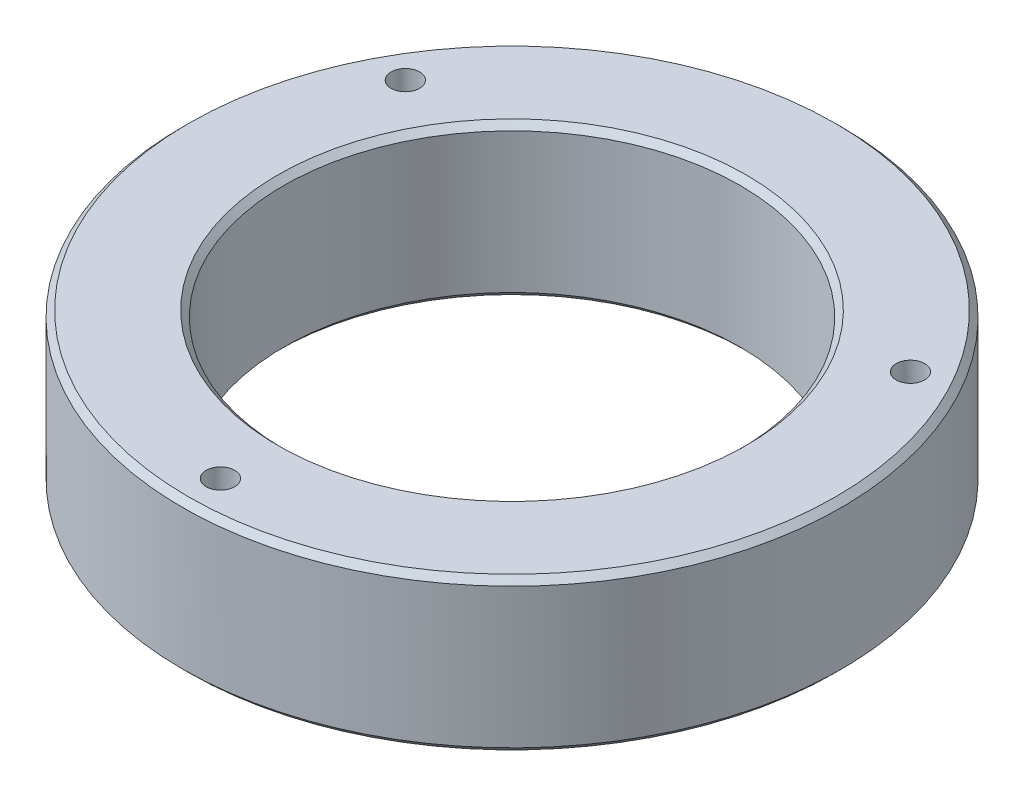
from build123d import *

# Parameters (mm, degrees)
SKETCH1_W           = 38.1
SKETCH1_H           = 25.3746
CHAMFER1_SIZE       = 1.524
CUT_EXTRUDE2_START  = -19.05
SKETCH2_R           = 3.5687
CUT_EXTRUDE2_DEPTH  = 76.2
CUT_EXTRUDE4_START  = -19.05
SKETCH3_R           = 5.5626
CUT_EXTRUDE4_DEPTH  = 9.652
CUT_EXTRUDE6_START  = -19.05
SKETCH4_R           = 3.5687
CUT_EXTRUDE6_DEPTH  = 76.2
CUT_EXTRUDE8_START  = -19.05
SKETCH5_R           = 5.5626
CUT_EXTRUDE8_DEPTH  = 9.652
CUT_EXTRUDE10_START = -19.05
SKETCH6_R           = 3.5687
CUT_EXTRUDE10_DEPTH = 76.2
CUT_EXTRUDE12_START = -19.05
SKETCH7_R           = 5.5626
CUT_EXTRUDE12_DEPTH = 9.652
CUT_EXTRUDE14_START = -19.05
SKETCH8_R           = 3.96875
CUT_EXTRUDE14_DEPTH = 25.4
CUT_EXTRUDE16_START = -19.05
SKETCH9_R           = 3.96875
CUT_EXTRUDE16_DEPTH = 25.4


with BuildPart() as part:
    # Sketch1 → Revolve1 (revolve)
    with BuildSketch(Plane(origin=(0, 0, 0), x_dir=(0, 1, 0), z_dir=(0, 0, 1)), mode=Mode.PRIVATE) as revolve1_sk:
        with Locations((0, 69.8373)):
            Rectangle(SKETCH1_W, SKETCH1_H)
    revolve(revolve1_sk.sketch.rotate(Axis((0, -44.45, 0), (0, 1, 0)), 270), axis=Axis((0, -44.45, 0), (0, 1, 0)))

    # Chamfer1
    chamfer1_edges = [part.edges().sort_by_distance(p)[0] for p in [
        (0, -19.05, 57.15),
        (0, 19.05, 57.15),
        (0, 19.05, 82.5246),
        (0, -19.05, 82.5246),
    ]]
    chamfer(chamfer1_edges, length=CHAMFER1_SIZE)

    # Sketch2 → Cut-Extrude2 (cut)
    with BuildSketch(Plane(origin=(0, 0, 0), x_dir=(-1, 0, 0), z_dir=(0, 1, 0)).offset(CUT_EXTRUDE2_START)):
        with Locations(Location((0, 73.025, 0), (0, 0, 270))):
            Circle(SKETCH2_R)
    extrude(amount=CUT_EXTRUDE2_DEPTH, mode=Mode.SUBTRACT)

    # Sketch3 → Cut-Extrude4 (cut)
    with BuildSketch(Plane(origin=(0, 0, 0), x_dir=(-1, 0, 0), z_dir=(0, 1, 0)).offset(CUT_EXTRUDE4_START)):
        with Locations(Location((0, 73.025, 0), (0, 0, 90))):
            Circle(SKETCH3_R)
    extrude(amount=CUT_EXTRUDE4_DEPTH, mode=Mode.SUBTRACT)

    # Sketch4 → Cut-Extrude6 (cut)
    with BuildSketch(Plane(origin=(0, 0, 0), x_dir=(-1, 0, 0), z_dir=(0, 1, 0)).offset(CUT_EXTRUDE6_START)):
        with Locations(Location((-63.246, -36.5252, 0), (0, 0, 270))):
            Circle(SKETCH4_R)
    extrude(amount=CUT_EXTRUDE6_DEPTH, mode=Mode.SUBTRACT)

    # Sketch5 → Cut-Extrude8 (cut)
    with BuildSketch(Plane(origin=(0, 0, 0), x_dir=(-1, 0, 0), z_dir=(0, 1, 0)).offset(CUT_EXTRUDE8_START)):
        with Locations(Location((-63.246, -36.5252, 0), (0, 0, 90))):
            Circle(SKETCH5_R)
    extrude(amount=CUT_EXTRUDE8_DEPTH, mode=Mode.SUBTRACT)

    # Sketch6 → Cut-Extrude10 (cut)
    with BuildSketch(Plane(origin=(0, 0, 0), x_dir=(-1, 0, 0), z_dir=(0, 1, 0)).offset(CUT_EXTRUDE10_START)):
        with Locations(Location((63.246, -36.5252, 0), (0, 0, 270))):
            Circle(SKETCH6_R)
    extrude(amount=CUT_EXTRUDE10_DEPTH, mode=Mode.SUBTRACT)

    # Sketch7 → Cut-Extrude12 (cut)
    with BuildSketch(Plane(origin=(0, 0, 0), x_dir=(-1, 0, 0), z_dir=(0, 1, 0)).offset(CUT_EXTRUDE12_START)):
        with Locations(Location((63.246, -36.5252, 0), (0, 0, 90))):
            Circle(SKETCH7_R)
    extrude(amount=CUT_EXTRUDE12_DEPTH, mode=Mode.SUBTRACT)

    # Sketch8 → Cut-Extrude14 (cut)
    with BuildSketch(Plane(origin=(0, 0, 0), x_dir=(-1, 0, 0), z_dir=(0, 1, 0)).offset(CUT_EXTRUDE14_START)):
        with Locations(Location((-69.85, 0, 0), (0, 0, 90))):
            Circle(SKETCH8_R)
    extrude(amount=CUT_EXTRUDE14_DEPTH, mode=Mode.SUBTRACT)

    # Sketch9 → Cut-Extrude16 (cut)
    with BuildSketch(Plane(origin=(0, 0, 0), x_dir=(-1, 0, 0), z_dir=(0, 1, 0)).offset(CUT_EXTRUDE16_START)):
        with Locations(Location((69.85, 0, 0), (0, 0, 90))):
            Circle(SKETCH9_R)
    extrude(amount=CUT_EXTRUDE16_DEPTH, mode=Mode.SUBTRACT)


solid = part.part
